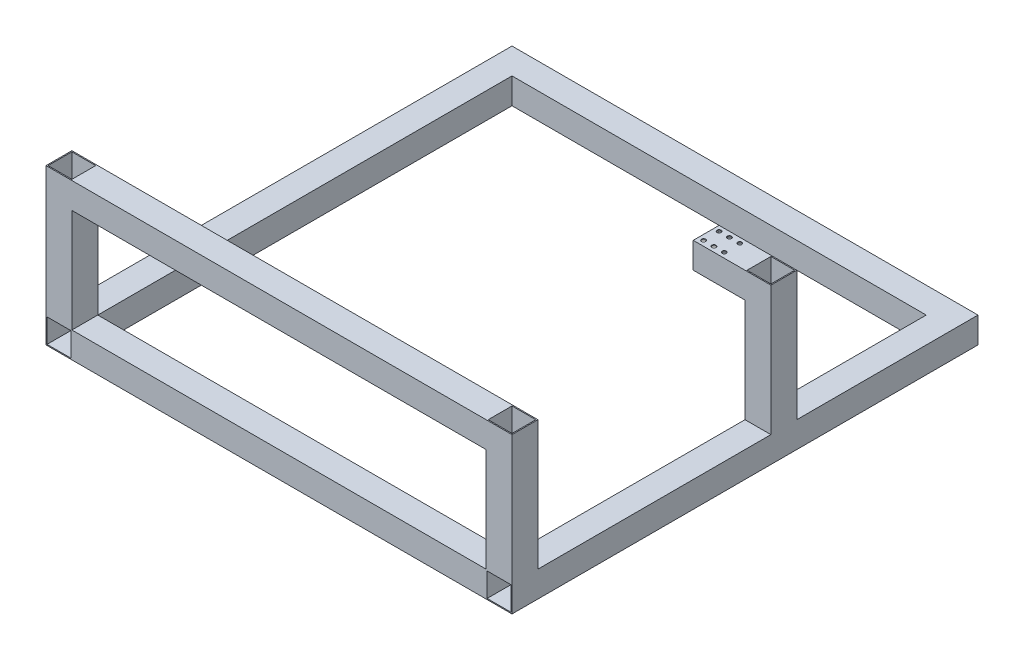
from build123d import *

# Parameters (mm, degrees)
SKETCH1_W           = 25
SKETCH1_H           = 25
SKETCH1_W_2         = 23
SKETCH1_H_2         = 23
BOSS_EXTRUDE1_DEPTH = 450
SKETCH2_W           = 25
SKETCH2_H           = 25
SKETCH2_W_2         = 23
SKETCH2_H_2         = 23
BOSS_EXTRUDE2_DEPTH = 200
SKETCH3_W           = 25
SKETCH3_H           = 25
SKETCH3_W_2         = 23
SKETCH3_H_2         = 23
BOSS_EXTRUDE3_DEPTH = 200
SKETCH4_W           = 25
SKETCH4_H           = 25
SKETCH4_W_2         = 23
SKETCH4_H_2         = 23
BOSS_EXTRUDE4_DEPTH = 125
SKETCH5_W           = 25
SKETCH5_H           = 25
SKETCH5_W_2         = 23
SKETCH5_H_2         = 23
BOSS_EXTRUDE5_DEPTH = 50
SKETCH6_R           = 2
CUT_EXTRUDE1_DEPTH  = 25
SKETCH7_W           = 25
SKETCH7_H           = 25
SKETCH7_W_2         = 23
SKETCH7_H_2         = 23
BOSS_EXTRUDE6_DEPTH = 125
SKETCH8_W           = 25
SKETCH8_H           = 25
SKETCH8_W_2         = 23
SKETCH8_H_2         = 23
BOSS_EXTRUDE7_DEPTH = 400


with BuildPart() as part:
    # Sketch1 → Boss-Extrude1 (new body)
    with BuildSketch(Plane.XY):
        Rectangle(SKETCH1_W, SKETCH1_H)
        Rectangle(SKETCH1_W_2, SKETCH1_H_2, mode=Mode.SUBTRACT)
    boss_extrude1 = extrude(amount=BOSS_EXTRUDE1_DEPTH)

    # Sketch2 → Boss-Extrude2 (add)
    with BuildSketch(Plane(origin=(12.5, 0, 0), x_dir=(0, 0, -1), z_dir=(1, 0, 0))):
        with Locations((-437.5, 0)):
            Rectangle(SKETCH2_W, SKETCH2_H)
        with Locations((-437.5, 0)):
            Rectangle(SKETCH2_W_2, SKETCH2_H_2, mode=Mode.SUBTRACT)
    boss_extrude2 = extrude(amount=BOSS_EXTRUDE2_DEPTH)

    # Sketch3 → Boss-Extrude3 (add)
    with BuildSketch(Plane(origin=(12.5, 0, 0), x_dir=(0, 0, -1), z_dir=(1, 0, 0))):
        with Locations((-12.5, 0)):
            Rectangle(SKETCH3_W, SKETCH3_H)
        with Locations((-12.5, 0)):
            Rectangle(SKETCH3_W_2, SKETCH3_H_2, mode=Mode.SUBTRACT)
    boss_extrude3 = extrude(amount=BOSS_EXTRUDE3_DEPTH)

    # Mirror1: Boss-Extrude1, Boss-Extrude2, Boss-Extrude3 across plane
    add(boss_extrude1.mirror(Plane(origin=(212.5, 0, 0), x_dir=(0, 0, 1), z_dir=(1, 0, 0))))
    add(boss_extrude2.mirror(Plane(origin=(212.5, 0, 0), x_dir=(0, 0, 1), z_dir=(1, 0, 0))))
    add(boss_extrude3.mirror(Plane(origin=(212.5, 0, 0), x_dir=(0, 0, 1), z_dir=(1, 0, 0))))

    # Sketch4 → Boss-Extrude4 (add)
    with BuildSketch(Plane(origin=(0, 12.5, 0), x_dir=(1, 0, 0), z_dir=(0, 1, 0))):
        with Locations((425, -187.5)):
            Rectangle(SKETCH4_W, SKETCH4_H)
        with Locations((425, -187.5)):
            Rectangle(SKETCH4_W_2, SKETCH4_H_2, mode=Mode.SUBTRACT)
    extrude(amount=BOSS_EXTRUDE4_DEPTH)

    # Sketch5 → Boss-Extrude5 (add)
    with BuildSketch(Plane.ZY.offset(-412.5)):
        with Locations((187.5, 125)):
            Rectangle(SKETCH5_W, SKETCH5_H)
        with Locations((187.5, 125)):
            Rectangle(SKETCH5_W_2, SKETCH5_H_2, mode=Mode.SUBTRACT)
    extrude(amount=BOSS_EXTRUDE5_DEPTH)

    # Sketch6 → Cut-Extrude1 (cut)
    with BuildSketch(Plane(origin=(0, 137.5, 0), x_dir=(1, 0, 0), z_dir=(0, 1, 0))):
        with Locations(Location((367.5, -180, 0), (0, 0, 270))):
            Circle(SKETCH6_R)
        with Locations(Location((367.5, -195, 0), (0, 0, 270))):
            Circle(SKETCH6_R)
        with Locations(Location((377.5, -180, 0), (0, 0, 270))):
            Circle(SKETCH6_R)
        with Locations(Location((377.5, -195, 0), (0, 0, 270))):
            Circle(SKETCH6_R)
        with Locations(Location((387.5, -180, 0), (0, 0, 270))):
            Circle(SKETCH6_R)
        with Locations(Location((387.5, -195, 0), (0, 0, 270))):
            Circle(SKETCH6_R)
    extrude(amount=-CUT_EXTRUDE1_DEPTH, mode=Mode.SUBTRACT)

    # Sketch7 → Boss-Extrude6 (add)
    # profile 1 of 2: a face of its own
    with BuildSketch(Plane(origin=(0, 12.5, 0), x_dir=(1, 0, 0), z_dir=(0, 1, 0))):
        with Locations((425, -437.5)):
            Rectangle(SKETCH7_W, SKETCH7_H)
        with Locations((425, -437.5)):
            Rectangle(SKETCH7_W_2, SKETCH7_H_2, mode=Mode.SUBTRACT)
    # profile 2 of 2: a face of its own
    with BuildSketch(Plane(origin=(0, 12.5, 0), x_dir=(1, 0, 0), z_dir=(0, 1, 0))):
        with Locations((0, -437.5)):
            Rectangle(SKETCH7_W, SKETCH7_H)
        with Locations((0, -437.5)):
            Rectangle(SKETCH7_W_2, SKETCH7_H_2, mode=Mode.SUBTRACT)
    extrude(amount=BOSS_EXTRUDE6_DEPTH)

    # Sketch8 → Boss-Extrude7 (add)
    with BuildSketch(Plane.ZY.offset(-412.5)):
        with Locations((437.5, 125)):
            Rectangle(SKETCH8_W, SKETCH8_H)
        with Locations((437.5, 125)):
            Rectangle(SKETCH8_W_2, SKETCH8_H_2, mode=Mode.SUBTRACT)
    extrude(amount=BOSS_EXTRUDE7_DEPTH)


solid = part.part
